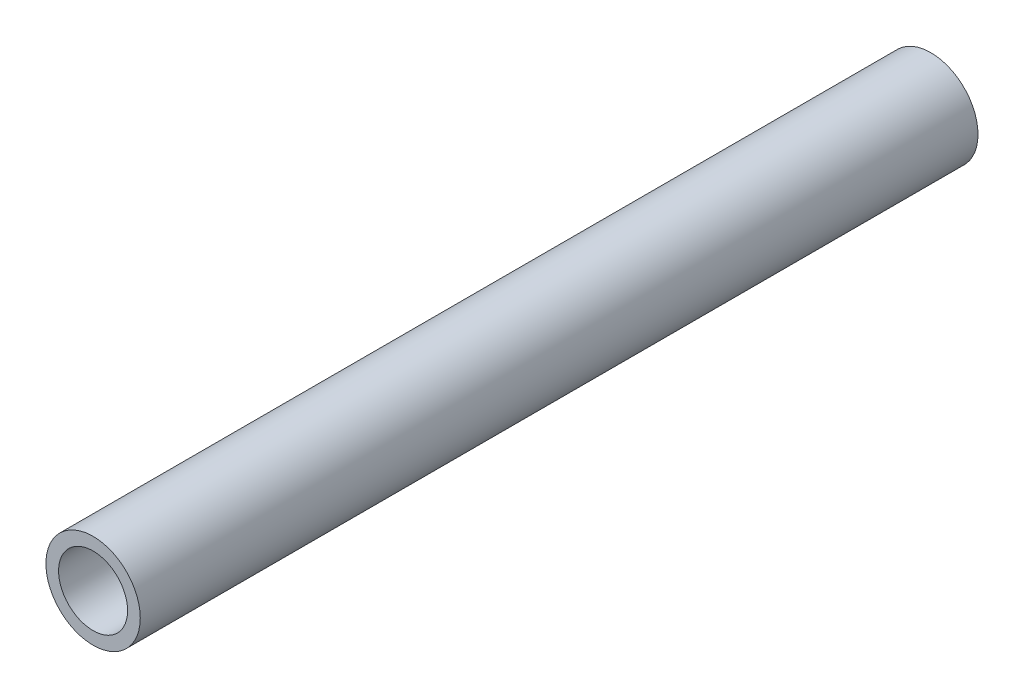
from build123d import *

# Parameters (mm, degrees)
CROQUIS1_R              = 10.7
CROQUIS1_R_2            = 7.825
SALIENTE_EXTRUIR1_DEPTH = 95


with BuildPart() as part:
    # Croquis1 → Saliente-Extruir1 (new, symmetric)
    with BuildSketch(Plane.XY):
        Circle(CROQUIS1_R)
        Circle(CROQUIS1_R_2, mode=Mode.SUBTRACT)
    extrude(amount=SALIENTE_EXTRUIR1_DEPTH, both=True)


solid = part.part
